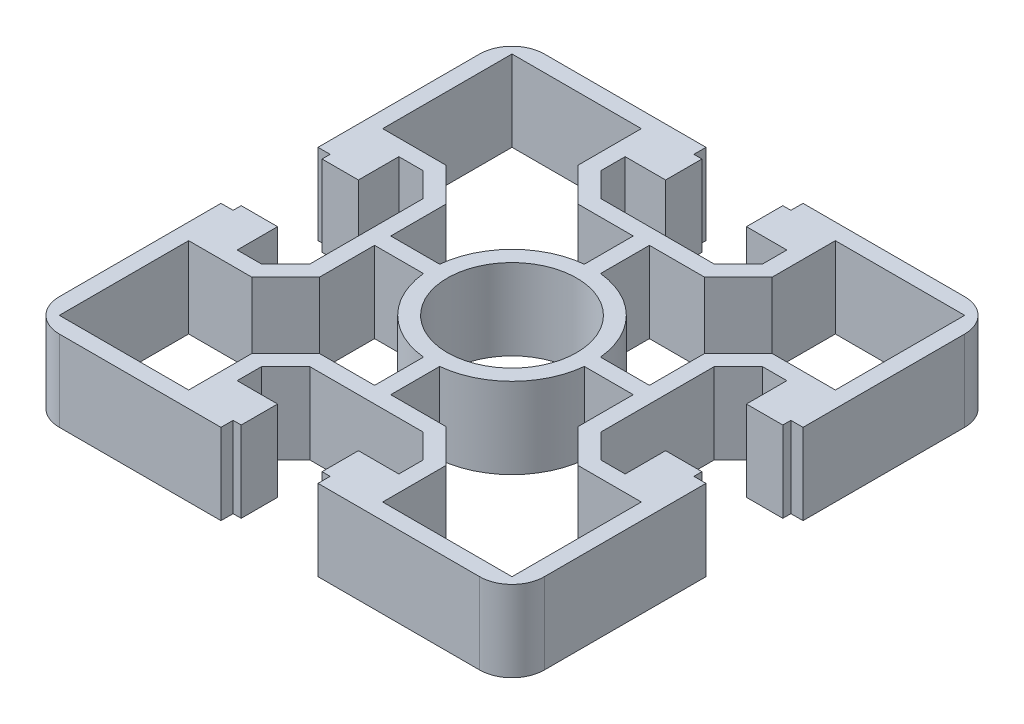
from build123d import *

# Parameters (mm, degrees)
SKETCH_1_R      = 8
EXTRUDE_1_DEPTH = 10


with BuildPart() as part:
    # 草图1 → 凸台-拉伸1 (new body)
    with BuildSketch(Plane(origin=(0, 0, 0), x_dir=(1, 0, 0), z_dir=(0, 1, 0))):
        with BuildLine():
            Line((-30, 5.999999999), (-28.5, 5.999999999))
            Line((-28.5, 5.999999999), (-28.5, 4.999999999))
            Line((-28.5, 4.999999999), (-24, 4.999999999))
            Line((-24, 4.999999999), (-24, 9.999999999))
            Line((-24, 9.999999999), (-21, 9.999999999))
            Line((-21, 9.999999999), (-18, 6.999999999))
            Line((-18, 6.999999999), (-18, -7.000000001))
            Line((-18, -7.000000001), (-21, -10.000000001))
            Line((-21, -10.000000001), (-24, -10.000000001))
            Line((-24, -10.000000001), (-24, -5.000000001))
            Line((-24, -5.000000001), (-28.5, -5.000000001))
            Line((-28.5, -5.000000001), (-28.5, -6.000000001))
            Line((-28.5, -6.000000001), (-30, -6.000000001))
            Line((-30, -6.000000001), (-30, -26.000000001))
            ThreePointArc((-30, -26.000000001), (-28.828427125, -28.828427126), (-26, -30.000000001))
            Line((-26, -30.000000001), (-6, -30.000000001))
            Line((-6, -30.000000001), (-6, -28.500000001))
            Line((-6, -28.500000001), (-5, -28.500000001))
            Line((-5, -28.500000001), (-5, -24.000000001))
            Line((-5, -24.000000001), (-10, -24.000000001))
            Line((-10, -24.000000001), (-10, -21.000000001))
            Line((-10, -21.000000001), (-7, -18.000000001))
            Line((-7, -18.000000001), (7, -18.000000001))
            Line((7, -18.000000001), (10, -21.000000001))
            Line((10, -21.000000001), (10, -24.000000001))
            Line((10, -24.000000001), (5, -24.000000001))
            Line((5, -24.000000001), (5, -28.500000001))
            Line((5, -28.500000001), (6, -28.500000001))
            Line((6, -28.500000001), (6, -30.000000001))
            Line((6, -30.000000001), (26, -30.000000001))
            ThreePointArc((26, -30.000000001), (28.828427125, -28.828427126), (30, -26.000000001))
            Line((30, -26.000000001), (30, -6.000000001))
            Line((30, -6.000000001), (28.5, -6.000000001))
            Line((28.5, -6.000000001), (28.5, -5.000000001))
            Line((28.5, -5.000000001), (24, -5.000000001))
            Line((24, -5.000000001), (24, -10.000000001))
            Line((24, -10.000000001), (21, -10.000000001))
            Line((21, -10.000000001), (18, -7.000000001))
            Line((18, -7.000000001), (18, 6.999999999))
            Line((18, 6.999999999), (21, 9.999999999))
            Line((21, 9.999999999), (24, 9.999999999))
            Line((24, 9.999999999), (24, 4.999999999))
            Line((24, 4.999999999), (28.5, 4.999999999))
            Line((28.5, 4.999999999), (28.5, 5.999999999))
            Line((28.5, 5.999999999), (30, 5.999999999))
            Line((30, 5.999999999), (30, 25.999999999))
            ThreePointArc((30, 25.999999999), (28.828427125, 28.828427124), (26, 29.999999999))
            Line((26, 29.999999999), (6, 29.999999999))
            Line((6, 29.999999999), (6, 28.499999999))
            Line((6, 28.499999999), (5, 28.499999999))
            Line((5, 28.499999999), (5, 23.999999999))
            Line((5, 23.999999999), (10, 23.999999999))
            Line((10, 23.999999999), (10, 20.999999999))
            Line((10, 20.999999999), (7, 17.999999999))
            Line((7, 17.999999999), (-7, 17.999999999))
            Line((-7, 17.999999999), (-10, 20.999999999))
            Line((-10, 20.999999999), (-10, 23.999999999))
            Line((-10, 23.999999999), (-5, 23.999999999))
            Line((-5, 23.999999999), (-5, 28.499999999))
            Line((-5, 28.499999999), (-6, 28.499999999))
            Line((-6, 28.499999999), (-6, 29.999999999))
            Line((-6, 29.999999999), (-26.000000001, 29.999999999))
            ThreePointArc((-26.000000001, 29.999999999), (-28.828427125, 28.828427123), (-30, 25.999999999))
            Line((-30, 25.999999999), (-30, 5.999999999))
        make_face()
        with Locations(Location((0, 0, 0), (0, 0, 270))):
            Circle(SKETCH_1_R, mode=Mode.SUBTRACT)
        with BuildLine():
            Line((-16, 1), (-9.949874371, 1))
            ThreePointArc((-9.949874371, 1), (-7.071067812, 7.071067811), (-1.000000001, 9.949874371))
            Line((-1.000000001, 9.949874371), (-1.000000001, 16))
            Line((-1.000000001, 16), (-7.828427125, 16))
            Line((-7.828427125, 16), (-12, 20.171572875))
            Line((-12, 20.171572875), (-12, 28))
            Line((-12, 28), (-28, 28))
            Line((-28, 28), (-28, 12))
            Line((-28, 12), (-20.171572875, 12))
            Line((-20.171572875, 12), (-16, 7.828427125))
            Line((-16, 7.828427125), (-16, 1))
        make_face(mode=Mode.SUBTRACT)
        with BuildLine():
            Line((1, 9.949874371), (1, 16))
            Line((1, 16), (7.828427125, 16))
            Line((7.828427125, 16), (12, 20.171572875))
            Line((12, 20.171572875), (12, 28))
            Line((12, 28), (28, 28))
            Line((28, 28), (28, 12.000000001))
            Line((28, 12.000000001), (20.171572875, 12.000000001))
            Line((20.171572875, 12.000000001), (16, 7.828427126))
            Line((16, 7.828427126), (16, 1.000000001))
            Line((16, 1.000000001), (9.949874371, 1.000000001))
            ThreePointArc((9.949874371, 1.000000001), (7.071067811, 7.071067812), (1, 9.949874371))
        make_face(mode=Mode.SUBTRACT)
        with BuildLine():
            Line((9.949874371, -1), (16, -1))
            Line((16, -1), (16, -7.828427125))
            Line((16, -7.828427125), (20.171572875, -12))
            Line((20.171572875, -12), (28.000000001, -12))
            Line((28.000000001, -12), (28.000000001, -28))
            Line((28.000000001, -28), (12.000000001, -28))
            Line((12.000000001, -28), (12.000000001, -20.171572875))
            Line((12.000000001, -20.171572875), (7.828427126, -16))
            Line((7.828427126, -16), (1.000000001, -16))
            Line((1.000000001, -16), (1.000000001, -9.949874371))
            ThreePointArc((1.000000001, -9.949874371), (7.071067812, -7.071067811), (9.949874371, -1))
        make_face(mode=Mode.SUBTRACT)
        with BuildLine():
            Line((-1, -9.949874371), (-1, -16.000000001))
            Line((-1, -16.000000001), (-7.828427125, -16.000000001))
            Line((-7.828427125, -16.000000001), (-12, -20.171572876))
            Line((-12, -20.171572876), (-12, -28.000000001))
            Line((-12, -28.000000001), (-28, -28.000000001))
            Line((-28, -28.000000001), (-28, -12.000000001))
            Line((-28, -12.000000001), (-20.171572875, -12.000000001))
            Line((-20.171572875, -12.000000001), (-16, -7.828427126))
            Line((-16, -7.828427126), (-16, -1.000000001))
            Line((-16, -1.000000001), (-9.949874371, -1.000000001))
            ThreePointArc((-9.949874371, -1.000000001), (-7.071067811, -7.071067812), (-1, -9.949874371))
        make_face(mode=Mode.SUBTRACT)
    extrude(amount=EXTRUDE_1_DEPTH)


solid = part.part
